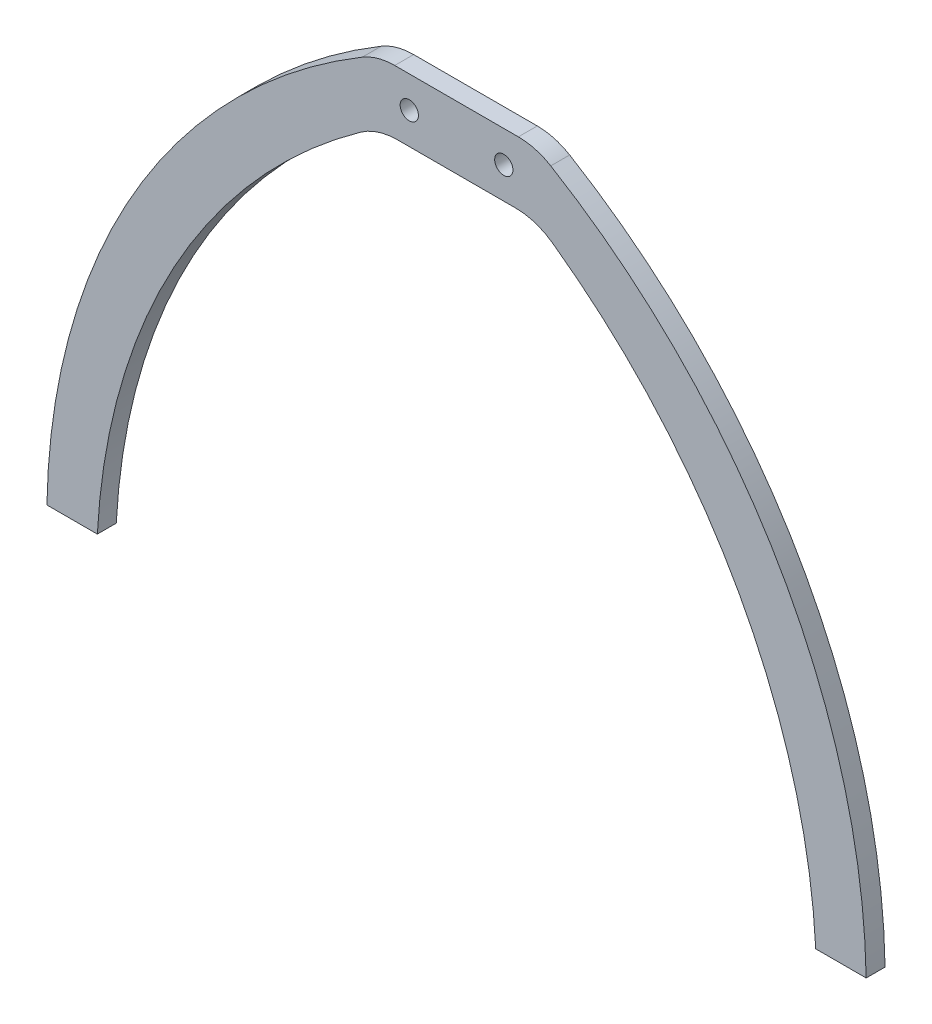
from build123d import *

# Parameters (mm, degrees)
SKETCH_1_R      = 1.45
EXTRUDE_1_DEPTH = 3
FILLET_1_R      = 10


with BuildPart() as part:
    # 草图1 → 凸台-拉伸1 (new body)
    with BuildSketch(Plane.XY):
        with BuildLine():
            Line((0, 0), (25, 0))
            ThreePointArc((25, 0), (56.497933188, -33.723935553), (69.5, -78))
            Line((69.5, -78), (77.5, -78))
            ThreePointArc((77.5, -78), (62.96989722, -27.008015863), (25, 10))
            Line((25, 10), (0, 10))
            ThreePointArc((0, 10), (-37.96989722, -27.008015863), (-52.5, -78))
            Line((-52.5, -78), (-44.5, -78))
            ThreePointArc((-44.5, -78), (-31.497933188, -33.723935553), (0, 0))
        make_face()
        with Locations((5, 5)):
            Circle(SKETCH_1_R, mode=Mode.SUBTRACT)
        with Locations((20, 5)):
            Circle(SKETCH_1_R, mode=Mode.SUBTRACT)
    extrude(amount=EXTRUDE_1_DEPTH)

    # 圆角1
    fillet_1_edges = [part.edges().sort_by_distance(p)[0] for p in [
        (0, 10, 1.5),
        (25, 10, 1.5),
        (25, 0, 1.5),
        (0, 0, 1.5),
    ]]
    fillet(fillet_1_edges, radius=FILLET_1_R)


solid = part.part
